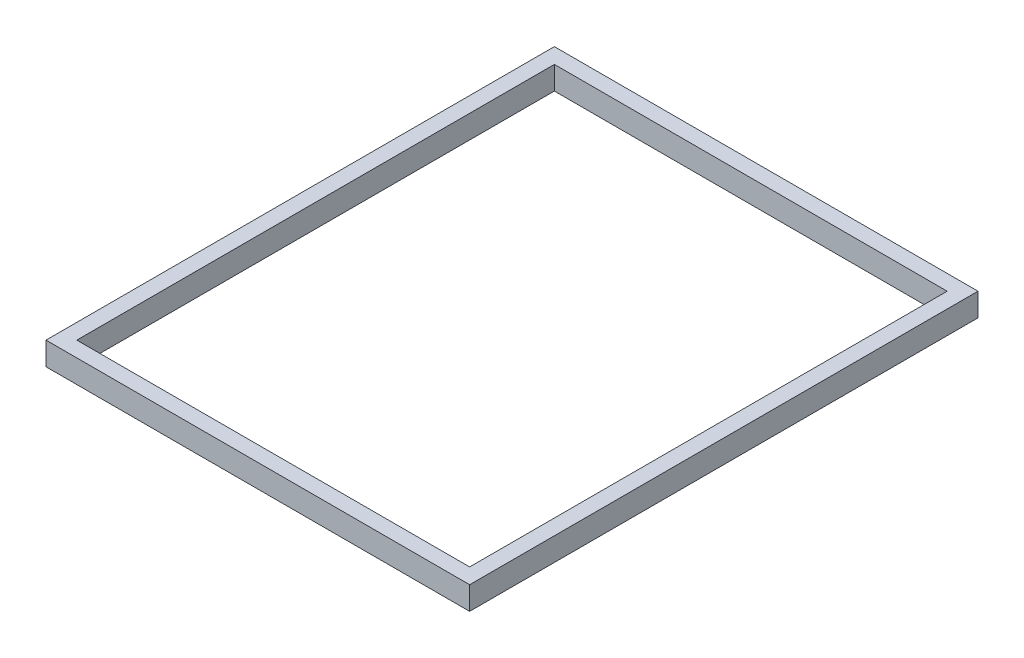
from build123d import *

# Parameters (mm, degrees)
SKETCH1_W           = 69.85
SKETCH1_H           = 83.82
SKETCH1_W_2         = 64.77
SKETCH1_H_2         = 78.74
BOSS_EXTRUDE1_DEPTH = 3.81


with BuildPart() as part:
    # Sketch1 → Boss-Extrude1 (new body)
    with BuildSketch(Plane(origin=(0, 0, 0), x_dir=(1, 0, 0), z_dir=(0, 1, 0))):
        Rectangle(SKETCH1_W, SKETCH1_H)
        Rectangle(SKETCH1_W_2, SKETCH1_H_2, mode=Mode.SUBTRACT)
    extrude(amount=BOSS_EXTRUDE1_DEPTH)


solid = part.part
